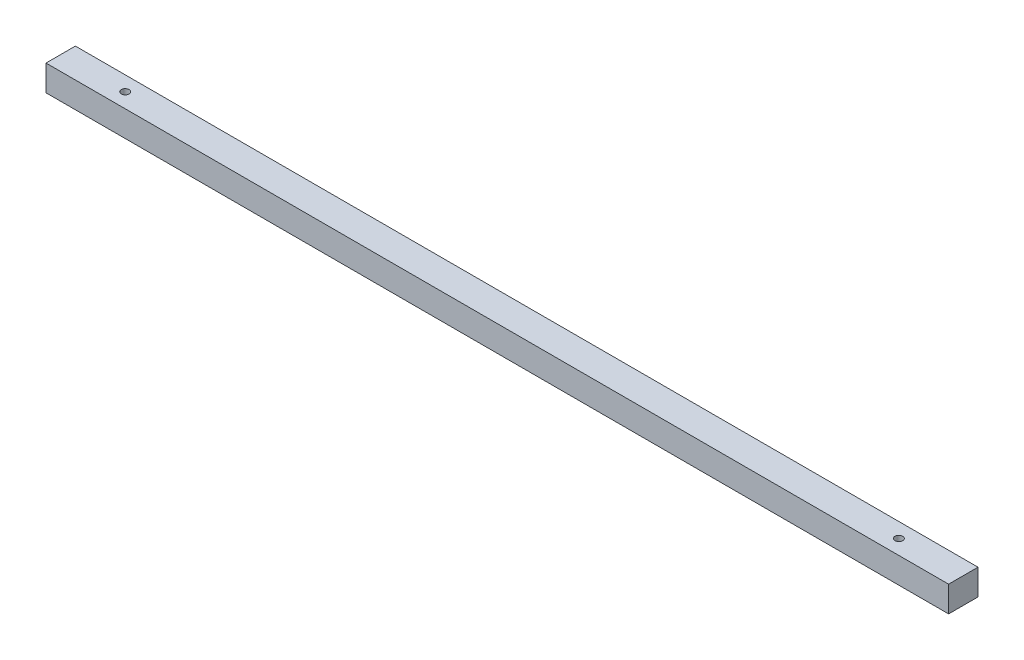
from build123d import *

# Parameters (mm, degrees)
SKETCH_1_W      = 350
SKETCH_1_H      = 11.4
SKETCH_1_R      = 1.5
EXTRUDE_1_DEPTH = 10


with BuildPart() as part:
    # 草图1 → 凸台-拉伸1 (new body)
    with BuildSketch(Plane(origin=(0, 0, 0), x_dir=(1, 0, 0), z_dir=(0, 1, 0))):
        Rectangle(SKETCH_1_W, SKETCH_1_H)
        with Locations(Location((-150, 0, 0), (0, 0, 270))):
            Circle(SKETCH_1_R, mode=Mode.SUBTRACT)
        with Locations(Location((150, 0, 0), (0, 0, 270))):
            Circle(SKETCH_1_R, mode=Mode.SUBTRACT)
    extrude(amount=EXTRUDE_1_DEPTH)


solid = part.part
